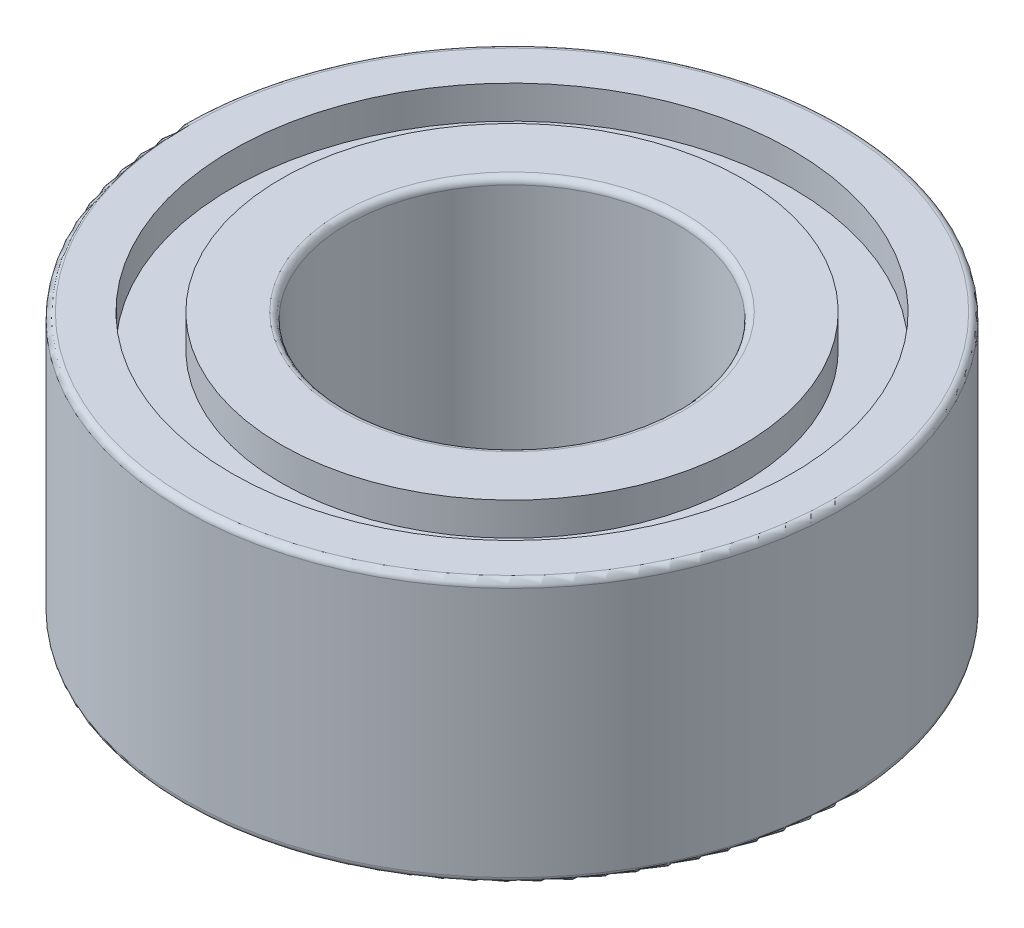
from build123d import *

# Parameters (mm, degrees)
BOSS_EXTRUDE1_DEPTH      = 2
BOSS_EXTRUDE1_DEPTH_BACK = 2
SKETCH1_R                = 5
SKETCH1_R_2              = 2.5
FILLET1_R                = 0.1
SKETCH2_R                = 4.25
SKETCH2_R_2              = 3.5
CUT_EXTRUDE1_DEPTH       = 0.5


with BuildPart() as part:
    # Sketch1 → Boss-Extrude1 (new, two sides: drawn at the far end of the back side and taken through both)
    with BuildSketch(Plane(origin=(0, 0, 0), x_dir=(1, 0, 0), z_dir=(0, 1, 0)).offset(-BOSS_EXTRUDE1_DEPTH_BACK)):
        Circle(SKETCH1_R)
        Circle(SKETCH1_R_2, mode=Mode.SUBTRACT)
    extrude(amount=BOSS_EXTRUDE1_DEPTH + BOSS_EXTRUDE1_DEPTH_BACK)

    # Fillet1
    fillet1_edges = [part.edges().sort_by_distance(p)[0] for p in [
        (-2.5, -2, 0),
        (-5, -2, 0),
        (-5, 2, 0),
        (-2.5, 2, 0),
    ]]
    fillet(fillet1_edges, radius=FILLET1_R)

    # Sketch2 → Cut-Extrude1 (cut)
    with BuildSketch(Plane(origin=(0, 2, 0), x_dir=(1, 0, 0), z_dir=(0, 1, 0))):
        Circle(SKETCH2_R)
        Circle(SKETCH2_R_2, mode=Mode.SUBTRACT)
    cut_extrude1 = extrude(amount=-CUT_EXTRUDE1_DEPTH, mode=Mode.SUBTRACT)

    # Mirror1: Cut-Extrude1 across plane
    add(cut_extrude1.mirror(Plane.ZX), mode=Mode.SUBTRACT)


solid = part.part
